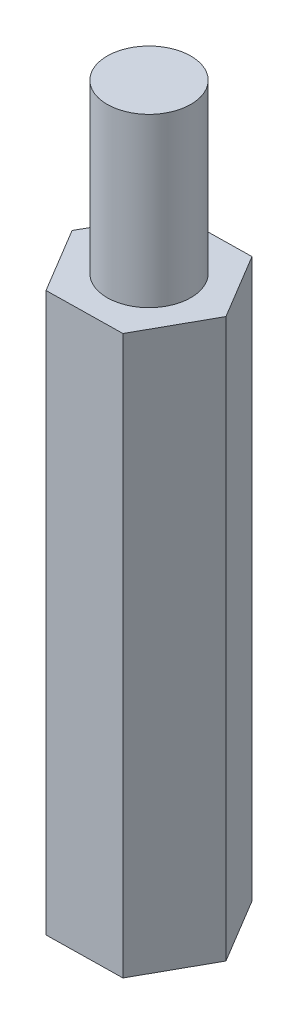
from build123d import *

# Parameters (mm, degrees)
SKETCH_1_R      = 1.5
EXTRUDE_1_DEPTH = 20
SKETCH_2_R      = 1.5
EXTRUDE_2_DEPTH = 6


with BuildPart() as part:
    # 草图1 → 凸台-拉伸1 (new body)
    with BuildSketch(Plane(origin=(0, 0, 0), x_dir=(1, 0, 0), z_dir=(0, 1, 0))):
        Polygon((1.394530192, -2.327792705), (2.713192713, 0.04380222), (1.318662521, 2.371594925), (-1.394530192, 2.327792705), (-2.713192713, -0.04380222), (-1.318662521, -2.371594925), align=None)
        with Locations(Location((0, 0, 0), (0, 0, 270))):
            Circle(SKETCH_1_R, mode=Mode.SUBTRACT)
    extrude(amount=EXTRUDE_1_DEPTH)


with BuildPart() as body_2:
    # 草图2 → 凸台-拉伸2 (new body)
    with BuildSketch(Plane(origin=(0, 20, 0), x_dir=(1, 0, 0), z_dir=(0, 1, 0))):
        with Locations(Location((0, 0, 0), (0, 0, 270))):
            Circle(SKETCH_2_R)
    extrude(amount=EXTRUDE_2_DEPTH)


solid = Compound([part.part, body_2.part])
